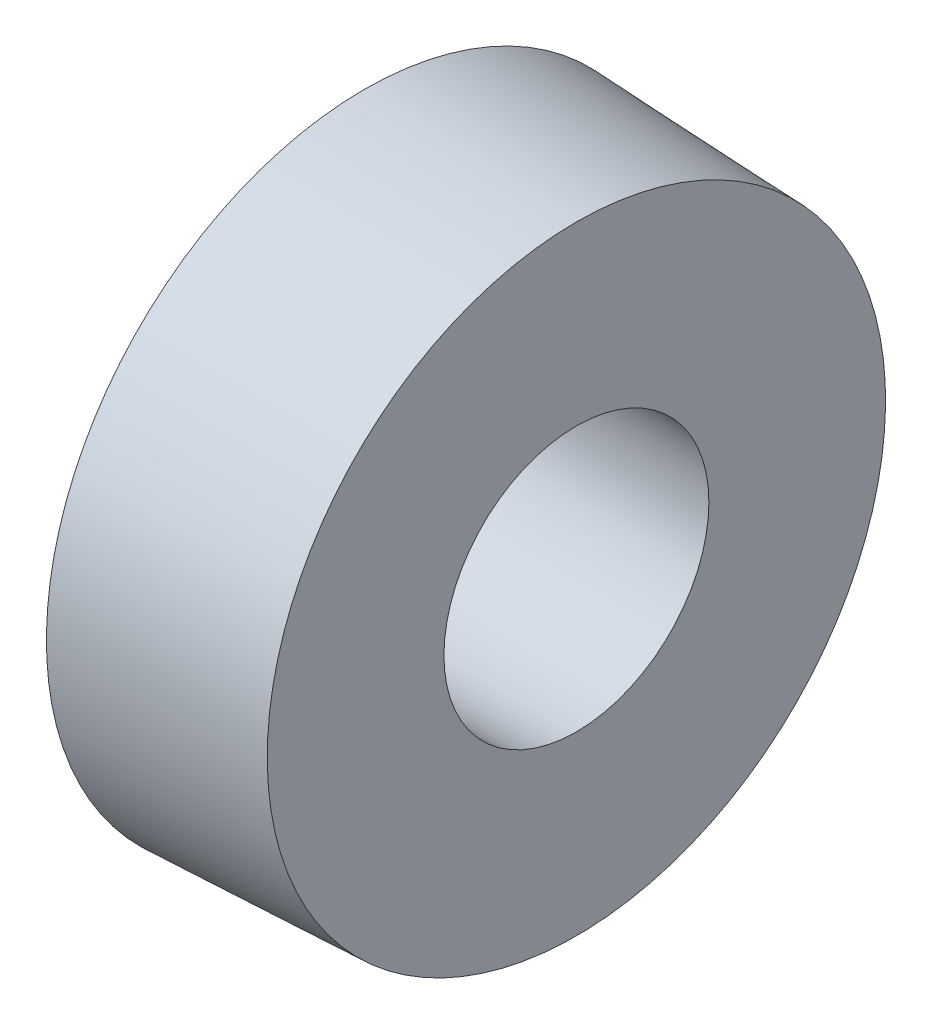
from build123d import *

# Parameters (mm, degrees)
REVOLVE1_ANGLE = 359.999999589


with BuildPart() as part:
    # Sketch1 → Revolve1 (revolve)
    with BuildSketch(Plane.XY):
        Polygon((6120, 300), (6120, 720), (6600, 700), (6600, 300), align=None)
    revolve(axis=Axis((0, 0, 0), (1, 0, 0)), revolution_arc=REVOLVE1_ANGLE)


solid = part.part
